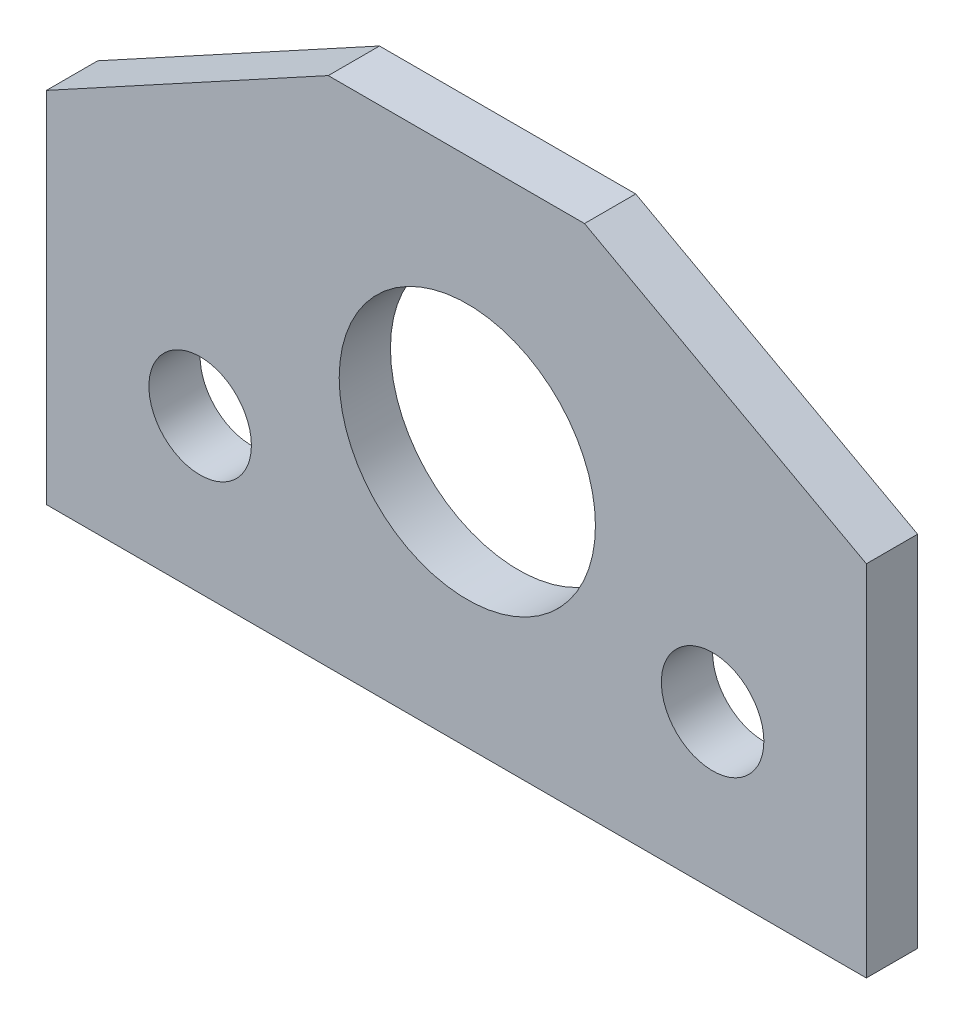
from build123d import *

# Parameters (mm, degrees)
BOSS_EXTRUDE1_DEPTH = 6.35
SKETCH2_R           = 6.35
SKETCH2_R_2         = 15.875
CUT_EXTRUDE1_DEPTH  = 108.791218051


with BuildPart() as part:
    # Sketch1 → Boss-Extrude1 (new body)
    with BuildSketch(Plane.XY):
        Polygon((-65.667548077, 38.206850962), (-33.917548077, 38.206850962), (1.007451923, 19.156850962), (1.007451923, -25.293149038), (-100.592548077, -25.293149038), (-100.592548077, 19.156850962), align=None)
    extrude(amount=BOSS_EXTRUDE1_DEPTH)

    # Sketch2 → Cut-Extrude1 (cut, through all)
    with BuildSketch(Plane.XY.offset(6.35)):
        with Locations((-81.542548077, -6.243149038)):
            Circle(SKETCH2_R)
        with Locations((-48.437164851, 6.456850962)):
            Circle(SKETCH2_R_2)
        with Locations((-18.042548077, -6.243149038)):
            Circle(SKETCH2_R)
    extrude(amount=-CUT_EXTRUDE1_DEPTH, mode=Mode.SUBTRACT)


solid = part.part
